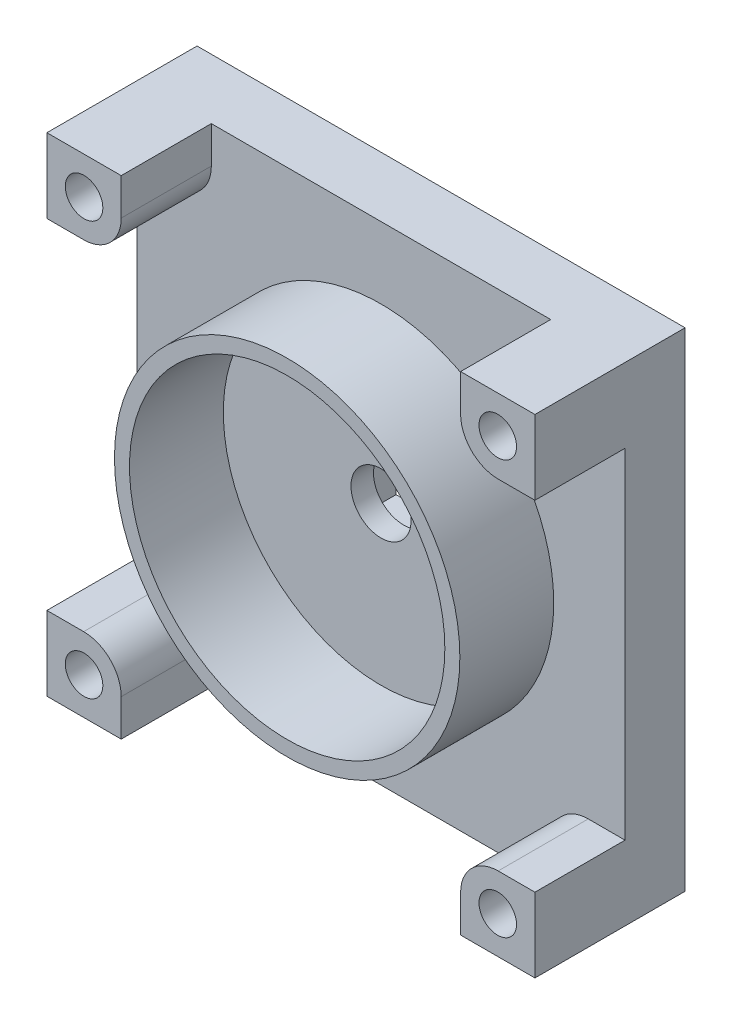
from build123d import *

# Parameters (mm, degrees)
CROQUIS1_R              = 23
CROQUIS1_R_2            = 21
SALIENTE_EXTRUIR1_DEPTH = 12.5
CROQUIS2_W              = 65
CROQUIS2_H              = 65
CROQUIS2_R              = 2.5
SALIENTE_EXTRUIR2_DEPTH = 8
CROQUIS3_W              = 12
CROQUIS3_H              = 12
CORTAR_EXTRUIR1_DEPTH   = 5
CORTAR_EXTRUIR2_REACH   = 50.505
CROQUIS4_R              = 4
SALIENTE_EXTRUIR3_START = 12
CROQUIS5_R              = 2.5
SALIENTE_EXTRUIR3_DEPTH = 12


with BuildPart() as part:
    # Croquis1 → Saliente-Extruir1 (new body)
    with BuildSketch(Plane.XY):
        Circle(CROQUIS1_R)
        Circle(CROQUIS1_R_2, mode=Mode.SUBTRACT)
    extrude(amount=SALIENTE_EXTRUIR1_DEPTH)

    # Croquis2 → Saliente-Extruir2 (add)
    with BuildSketch(Plane.XY):
        Rectangle(CROQUIS2_W, CROQUIS2_H)
        with Locations((-27.550252532, 27.550252532)):
            Circle(CROQUIS2_R, mode=Mode.SUBTRACT)
        with Locations((27.550252532, 27.550252532)):
            Circle(CROQUIS2_R, mode=Mode.SUBTRACT)
        with Locations((-27.550252532, -27.550252532)):
            Circle(CROQUIS2_R, mode=Mode.SUBTRACT)
        with Locations((27.550252532, -27.550252532)):
            Circle(CROQUIS2_R, mode=Mode.SUBTRACT)
    extrude(amount=-SALIENTE_EXTRUIR2_DEPTH)

    # Croquis3 → Cortar-Extruir1 (cut)
    with BuildSketch(Plane(origin=(0, 0, -8), x_dir=(-1, 0, 0), z_dir=(0, 0, -1))):
        Rectangle(CROQUIS3_W, CROQUIS3_H)
    extrude(amount=-CORTAR_EXTRUIR1_DEPTH, mode=Mode.SUBTRACT)

    # Croquis4 → Cortar-Extruir2 (cut, up to next)
    with BuildSketch(Plane(origin=(0, 0, -3), x_dir=(-1, 0, 0), z_dir=(0, 0, -1)), mode=Mode.PRIVATE) as cortar_extruir2_sk1:
        Circle(CROQUIS4_R)
    cortar_extruir2_tool1 = extrude(cortar_extruir2_sk1.sketch, amount=-CORTAR_EXTRUIR2_REACH, mode=Mode.PRIVATE) & part.part
    add(cortar_extruir2_tool1.solids().sort_by_distance((0, 0, -3))[0], mode=Mode.SUBTRACT)

    # Croquis5 → Saliente-Extruir3 (add)
    # profile 1 of 4: a face of its own
    with BuildSketch(Plane.XY.offset(SALIENTE_EXTRUIR3_START)):
        with BuildLine():
            Line((27.600505063, 22.600505063), (32.5, 22.600505063))
            Line((32.5, 22.600505063), (32.5, 32.5))
            Line((32.5, 32.5), (22.600505063, 32.5))
            Line((22.600505063, 32.5), (22.600505063, 27.600505063))
            ThreePointArc((22.600505063, 27.600505063), (24.064971157, 24.064971157), (27.600505063, 22.600505063))
        make_face()
        with Locations((27.550252532, 27.550252532)):
            Circle(CROQUIS5_R, mode=Mode.SUBTRACT)
    # profile 2 of 4: a face of its own
    with BuildSketch(Plane.XY.offset(SALIENTE_EXTRUIR3_START)):
        with BuildLine():
            Line((-27.600505063, 22.600505063), (-32.5, 22.600505063))
            Line((-32.5, 22.600505063), (-32.5, 32.5))
            Line((-32.5, 32.5), (-22.600505063, 32.5))
            Line((-22.600505063, 32.5), (-22.600505063, 27.600505063))
            ThreePointArc((-22.600505063, 27.600505063), (-24.064971157, 24.064971157), (-27.600505063, 22.600505063))
        make_face()
        with Locations((-27.550252532, 27.550252532)):
            Circle(CROQUIS5_R, mode=Mode.SUBTRACT)
    # profile 3 of 4: a face of its own
    with BuildSketch(Plane.XY.offset(SALIENTE_EXTRUIR3_START)):
        with BuildLine():
            Line((-27.600505063, -22.600505063), (-32.5, -22.600505063))
            Line((-32.5, -22.600505063), (-32.5, -32.5))
            Line((-32.5, -32.5), (-22.600505063, -32.5))
            Line((-22.600505063, -32.5), (-22.600505063, -27.600505063))
            ThreePointArc((-22.600505063, -27.600505063), (-24.064971157, -24.064971157), (-27.600505063, -22.600505063))
        make_face()
        with Locations((-27.550252532, -27.550252532)):
            Circle(CROQUIS5_R, mode=Mode.SUBTRACT)
    # profile 4 of 4: a face of its own
    with BuildSketch(Plane.XY.offset(SALIENTE_EXTRUIR3_START)):
        with BuildLine():
            Line((27.600505063, -22.600505063), (32.5, -22.600505063))
            Line((32.5, -22.600505063), (32.5, -32.5))
            Line((32.5, -32.5), (22.600505063, -32.5))
            Line((22.600505063, -32.5), (22.600505063, -27.600505063))
            ThreePointArc((22.600505063, -27.600505063), (24.064971157, -24.064971157), (27.600505063, -22.600505063))
        make_face()
        with Locations((27.550252532, -27.550252532)):
            Circle(CROQUIS5_R, mode=Mode.SUBTRACT)
    extrude(amount=-SALIENTE_EXTRUIR3_DEPTH)


solid = part.part
